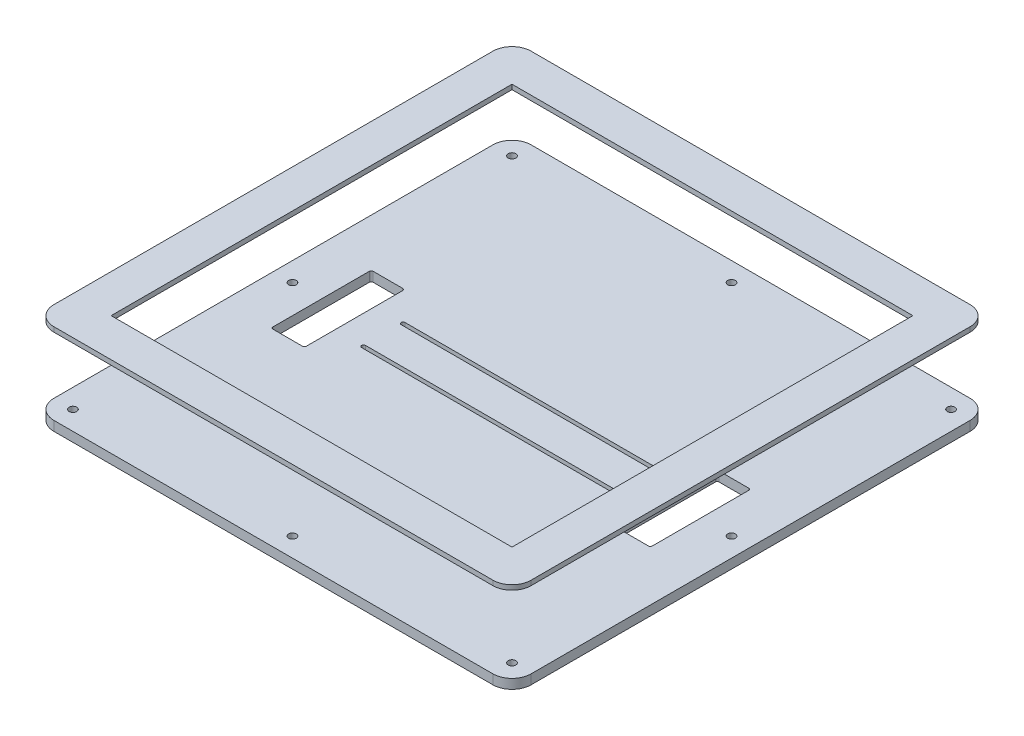
from build123d import *

# Parameters (mm, degrees)
SKETCH1_R           = 4
BOSS_EXTRUDE1_DEPTH = 10
SKETCH3_W           = 420
SKETCH3_H           = 420
BOSS_EXTRUDE2_DEPTH = 5
CUT_EXTRUDE1_DEPTH  = 10


with BuildPart() as part:
    # Sketch1 → Boss-Extrude1 (new body)
    with BuildSketch(Plane(origin=(0, 0, 0), x_dir=(1, 0, 0), z_dir=(0, 1, 0))):
        with BuildLine():
            Line((-230, -250), (230, -250))
            ThreePointArc((230, -250), (244.142135624, -244.142135624), (250, -230))
            Line((250, -230), (250, 230))
            ThreePointArc((250, 230), (244.142135624, 244.142135624), (230, 250))
            Line((230, 250), (-230, 250))
            ThreePointArc((-230, 250), (-244.142135624, 244.142135624), (-250, 230))
            Line((-250, 230), (-250, -230))
            ThreePointArc((-250, -230), (-244.142135624, -244.142135624), (-230, -250))
        make_face()
        with Locations(Location((-230, 230, 0), (0, 0, 270))):
            Circle(SKETCH1_R, mode=Mode.SUBTRACT)
        with Locations(Location((230, 230, 0), (0, 0, 270))):
            Circle(SKETCH1_R, mode=Mode.SUBTRACT)
        with Locations(Location((230, -230, 0), (0, 0, 270))):
            Circle(SKETCH1_R, mode=Mode.SUBTRACT)
        with Locations(Location((-230, -230, 0), (0, 0, 270))):
            Circle(SKETCH1_R, mode=Mode.SUBTRACT)
        with Locations(Location((0, 230, 0), (0, 0, 270))):
            Circle(SKETCH1_R, mode=Mode.SUBTRACT)
        with Locations(Location((-230, 0, 0), (0, 0, 270))):
            Circle(SKETCH1_R, mode=Mode.SUBTRACT)
        with Locations(Location((230, 0, 0), (0, 0, 90))):
            Circle(SKETCH1_R, mode=Mode.SUBTRACT)
        with Locations(Location((0, -230, 0), (0, 0, 90))):
            Circle(SKETCH1_R, mode=Mode.SUBTRACT)
        with BuildLine():
            Line((-198, -52.5), (-167, -52.5))
            ThreePointArc((-167, -52.5), (-165.585786438, -51.914213562), (-165, -50.5))
            Line((-165, -50.5), (-165, 50.5))
            ThreePointArc((-165, 50.5), (-165.585786438, 51.914213562), (-167, 52.5))
            Line((-167, 52.5), (-198, 52.5))
            ThreePointArc((-198, 52.5), (-199.414213562, 51.914213562), (-200, 50.5))
            Line((-200, 50.5), (-200, -50.5))
            ThreePointArc((-200, -50.5), (-199.414213562, -51.914213562), (-198, -52.5))
        make_face(mode=Mode.SUBTRACT)
        with BuildLine():
            Line((195.5, -52.5), (164.5, -52.5))
            ThreePointArc((164.5, -52.5), (163.085786438, -51.914213562), (162.5, -50.5))
            Line((162.5, -50.5), (162.5, 50.5))
            ThreePointArc((162.5, 50.5), (163.085786438, 51.914213562), (164.5, 52.5))
            Line((164.5, 52.5), (195.5, 52.5))
            ThreePointArc((195.5, 52.5), (196.914213562, 51.914213562), (197.5, 50.5))
            Line((197.5, 50.5), (197.5, -50.5))
            ThreePointArc((197.5, -50.5), (196.914213562, -51.914213562), (195.5, -52.5))
        make_face(mode=Mode.SUBTRACT)
    extrude(amount=-BOSS_EXTRUDE1_DEPTH)

    # Sketch10 → Cut-Extrude1 (cut)
    with BuildSketch(Plane(origin=(0, 0, 0), x_dir=(1, 0, 0), z_dir=(0, 1, 0))):
        with BuildLine():
            Line((-134.842461188, 22.75), (134.842461188, 22.75))
            ThreePointArc((134.842461188, 22.75), (136.842461188, 20.75), (134.842461188, 18.75))
            Line((134.842461188, 18.75), (-134.842461188, 18.75))
            ThreePointArc((-134.842461188, 18.75), (-136.842461188, 20.75), (-134.842461188, 22.75))
        make_face()
        with BuildLine():
            Line((-134.842461188, -18.75), (134.842461188, -18.75))
            ThreePointArc((134.842461188, -18.75), (136.842461188, -20.75), (134.842461188, -22.75))
            Line((134.842461188, -22.75), (-134.842461188, -22.75))
            ThreePointArc((-134.842461188, -22.75), (-136.842461188, -20.75), (-134.842461188, -18.75))
        make_face()
    extrude(amount=-CUT_EXTRUDE1_DEPTH, mode=Mode.SUBTRACT)


with BuildPart() as body_2:
    # Sketch3 → Boss-Extrude2 (new body)
    with BuildSketch(Plane(origin=(0, 80, 0), x_dir=(1, 0, 0), z_dir=(0, 1, 0))):
        with BuildLine():
            Line((-230, -250), (230, -250))
            ThreePointArc((230, -250), (244.142135624, -244.142135624), (250, -230))
            Line((250, -230), (250, 230))
            ThreePointArc((250, 230), (244.142135624, 244.142135624), (230, 250))
            Line((230, 250), (-230, 250))
            ThreePointArc((-230, 250), (-244.142135624, 244.142135624), (-250, 230))
            Line((-250, 230), (-250, -230))
            ThreePointArc((-250, -230), (-244.142135624, -244.142135624), (-230, -250))
        make_face()
        Rectangle(SKETCH3_W, SKETCH3_H, mode=Mode.SUBTRACT)
    extrude(amount=BOSS_EXTRUDE2_DEPTH)


solid = Compound([part.part, body_2.part])
